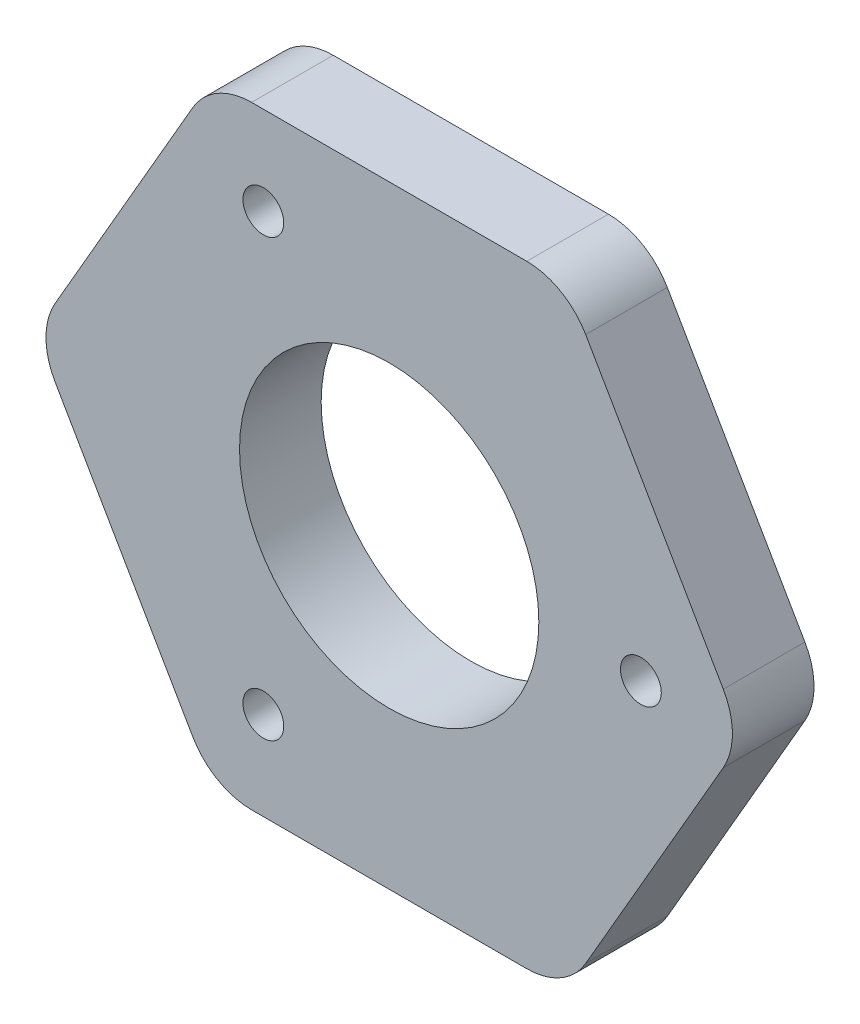
from build123d import *

# Parameters (mm, degrees)
SKETCH1_R           = 1.5
SKETCH1_R_2         = 11
BOSS_EXTRUDE1_DEPTH = 6


with BuildPart() as part:
    # Sketch1 → Boss-Extrude1 (new body)
    with BuildSketch(Plane.XY):
        with BuildLine():
            Line((-32.544346114, 48.773339502), (-22.43109746, 66.29))
            ThreePointArc((-22.43109746, 66.29), (-21.761224479, 68.79), (-22.43109746, 71.29))
            Line((-22.43109746, 71.29), (-32.544346114, 88.806660498))
            ThreePointArc((-32.544346114, 88.806660498), (-34.374473133, 90.636787517), (-36.874473133, 91.306660498))
            Line((-36.874473133, 91.306660498), (-57.100970441, 91.306660498))
            ThreePointArc((-57.100970441, 91.306660498), (-59.600970441, 90.636787517), (-61.43109746, 88.806660498))
            Line((-61.43109746, 88.806660498), (-71.544346114, 71.29))
            ThreePointArc((-71.544346114, 71.29), (-72.214219095, 68.79), (-71.544346114, 66.29))
            Line((-71.544346114, 66.29), (-61.43109746, 48.773339502))
            ThreePointArc((-61.43109746, 48.773339502), (-59.600970441, 46.943212483), (-57.100970441, 46.273339502))
            Line((-57.100970441, 46.273339502), (-36.874473133, 46.273339502))
            ThreePointArc((-36.874473133, 46.273339502), (-34.374473133, 46.943212483), (-32.544346114, 48.773339502))
        make_face()
        with Locations((-56.237721787, 84.81146997)):
            Circle(SKETCH1_R, mode=Mode.SUBTRACT)
        with Locations((-28.487721787, 68.79)):
            Circle(SKETCH1_R, mode=Mode.SUBTRACT)
        with Locations((-46.987721787, 68.79)):
            Circle(SKETCH1_R_2, mode=Mode.SUBTRACT)
        with Locations((-56.237721787, 52.76853003)):
            Circle(SKETCH1_R, mode=Mode.SUBTRACT)
    extrude(amount=BOSS_EXTRUDE1_DEPTH)


solid = part.part
